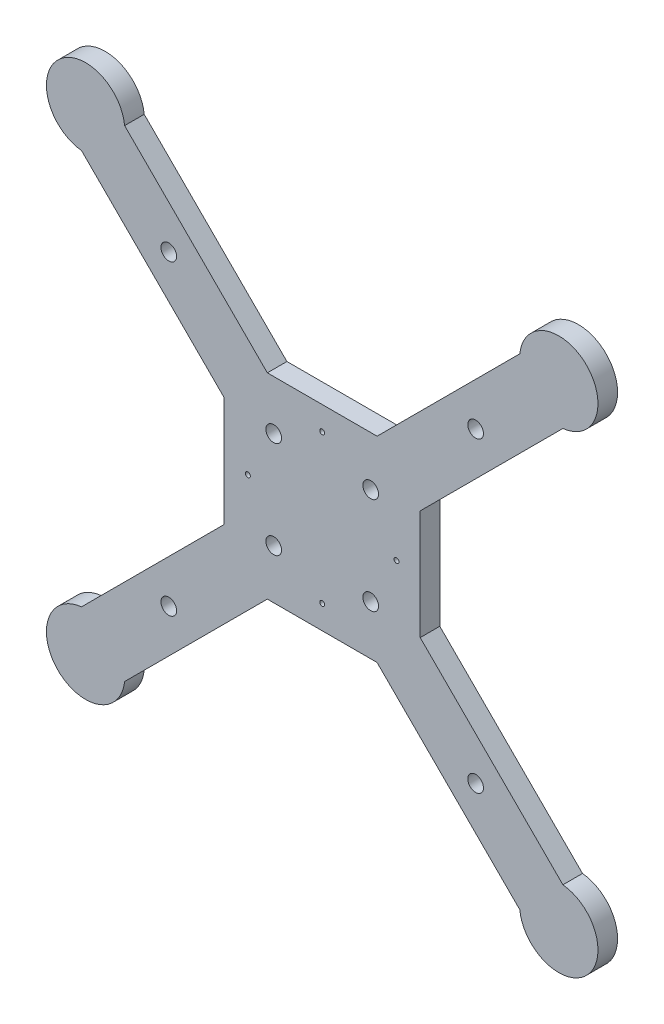
from build123d import *

# Parameters (mm, degrees)
ESQUISSE1_W             = 100
ESQUISSE1_H             = 100
BOSS_EXTRU_1_DEPTH      = 10
ESQUISSE3_R             = 4
ESQUISSE3_R_2           = 1.25
ENL_V_MAT_EXTRU_2_DEPTH = 200.246053595


with BuildPart() as part:
    # Esquisse1 → Boss.-Extru.1 (new body)
    with BuildSketch(Plane.XY):
        with BuildLine():
            ThreePointArc((-100.822483701, 122.822483701), (-134.852813742, 134.852813742), (-122.822483701, 100.822483701))
            Line((-122.822483701, 100.822483701), (-131.710678119, 109.710678119))
            Line((-131.710678119, 109.710678119), (-109.710678119, 131.710678119))
            Line((-109.710678119, 131.710678119), (-100.822483701, 122.822483701))
        make_face()
        with BuildLine():
            Line((-131.710678119, 109.710678119), (-122.822483701, 100.822483701))
            ThreePointArc((-122.822483701, 100.822483701), (-107.336002639, 105.840639254), (-100.710678119, 120.710678119))
            ThreePointArc((-100.710678119, 120.710678119), (-100.738649074, 121.768059709), (-100.822483701, 122.822483701))
            Line((-100.822483701, 122.822483701), (-109.710678119, 131.710678119))
            Line((-109.710678119, 131.710678119), (-131.710678119, 109.710678119))
        make_face()
        with BuildLine():
            Line((-122.822483701, 100.822483701), (-50, 28))
            Line((-50, 28), (-50, 50))
            Line((-50, 50), (-28, 50))
            Line((-28, 50), (-100.822483701, 122.822483701))
            ThreePointArc((-100.822483701, 122.822483701), (-100.738649074, 121.768059709), (-100.710678119, 120.710678119))
            ThreePointArc((-100.710678119, 120.710678119), (-107.336002639, 105.840639254), (-122.822483701, 100.822483701))
        make_face()
        with BuildLine():
            Line((100.822483701, 122.822483701), (28, 50))
            Line((28, 50), (50, 50))
            Line((50, 50), (50, 28))
            Line((50, 28), (122.822483701, 100.822483701))
            ThreePointArc((122.822483701, 100.822483701), (106.568542495, 106.568542495), (100.822483701, 122.822483701))
        make_face()
        with BuildLine():
            ThreePointArc((140.710678119, 120.710678119), (121.768059709, 140.682707164), (100.822483701, 122.822483701))
            Line((100.822483701, 122.822483701), (109.710678119, 131.710678119))
            Line((109.710678119, 131.710678119), (131.710678119, 109.710678119))
            Line((131.710678119, 109.710678119), (122.822483701, 100.822483701))
            ThreePointArc((122.822483701, 100.822483701), (135.580716983, 107.336002639), (140.710678119, 120.710678119))
        make_face()
        with BuildLine():
            Line((109.710678119, 131.710678119), (100.822483701, 122.822483701))
            ThreePointArc((100.822483701, 122.822483701), (106.568542495, 106.568542495), (122.822483701, 100.822483701))
            Line((122.822483701, 100.822483701), (131.710678119, 109.710678119))
            Line((131.710678119, 109.710678119), (109.710678119, 131.710678119))
        make_face()
        Rectangle(ESQUISSE1_W, ESQUISSE1_H)
        with BuildLine():
            ThreePointArc((122.822483701, -100.822483701), (106.568542495, -106.568542495), (100.822483701, -122.822483701))
            Line((100.822483701, -122.822483701), (109.710678119, -131.710678119))
            Line((109.710678119, -131.710678119), (131.710678119, -109.710678119))
            Line((131.710678119, -109.710678119), (122.822483701, -100.822483701))
        make_face()
        with BuildLine():
            Line((109.710678119, -131.710678119), (100.822483701, -122.822483701))
            ThreePointArc((100.822483701, -122.822483701), (121.768059709, -140.682707164), (140.710678119, -120.710678119))
            ThreePointArc((140.710678119, -120.710678119), (135.580716983, -107.336002639), (122.822483701, -100.822483701))
            Line((122.822483701, -100.822483701), (131.710678119, -109.710678119))
            Line((131.710678119, -109.710678119), (109.710678119, -131.710678119))
        make_face()
        with BuildLine():
            Line((50, -50), (28, -50))
            Line((28, -50), (100.822483701, -122.822483701))
            ThreePointArc((100.822483701, -122.822483701), (106.568542495, -106.568542495), (122.822483701, -100.822483701))
            Line((122.822483701, -100.822483701), (50, -28))
            Line((50, -28), (50, -50))
        make_face()
        with BuildLine():
            ThreePointArc((-100.710678119, -120.710678119), (-107.336002639, -105.840639254), (-122.822483701, -100.822483701))
            Line((-122.822483701, -100.822483701), (-131.710678119, -109.710678119))
            Line((-131.710678119, -109.710678119), (-109.710678119, -131.710678119))
            Line((-109.710678119, -131.710678119), (-100.822483701, -122.822483701))
            ThreePointArc((-100.822483701, -122.822483701), (-100.738649074, -121.768059709), (-100.710678119, -120.710678119))
        make_face()
        with BuildLine():
            Line((-131.710678119, -109.710678119), (-122.822483701, -100.822483701))
            ThreePointArc((-122.822483701, -100.822483701), (-134.852813742, -134.852813742), (-100.822483701, -122.822483701))
            Line((-100.822483701, -122.822483701), (-109.710678119, -131.710678119))
            Line((-109.710678119, -131.710678119), (-131.710678119, -109.710678119))
        make_face()
        with BuildLine():
            Line((-50, -50), (-50, -28))
            Line((-50, -28), (-122.822483701, -100.822483701))
            ThreePointArc((-122.822483701, -100.822483701), (-107.336002639, -105.840639254), (-100.710678119, -120.710678119))
            ThreePointArc((-100.710678119, -120.710678119), (-100.738649074, -121.768059709), (-100.822483701, -122.822483701))
            Line((-100.822483701, -122.822483701), (-28, -50))
            Line((-28, -50), (-50, -50))
        make_face()
    extrude(amount=BOSS_EXTRU_1_DEPTH)

    # Esquisse3 → Enlèv. mat.-Extru.2 (cut, through all)
    with BuildSketch(Plane(origin=(0, 0, 0), x_dir=(-1, 0, 0), z_dir=(0, 0, -1))):
        with Locations((-78.284271247, 78.284271247)):
            Circle(ESQUISSE3_R)
        with Locations((-24.748737342, 24.748737342)):
            Circle(ESQUISSE3_R)
        with Locations((78.284271247, 78.284271247)):
            Circle(ESQUISSE3_R)
        with Locations((24.748737342, 24.748737342)):
            Circle(ESQUISSE3_R)
        with Locations((78.284271247, -78.284271247)):
            Circle(ESQUISSE3_R)
        with Locations((24.748737342, -24.748737342)):
            Circle(ESQUISSE3_R)
        with Locations((-78.284271247, -78.284271247)):
            Circle(ESQUISSE3_R)
        with Locations((-24.748737342, -24.748737342)):
            Circle(ESQUISSE3_R)
        with Locations((-37.92, 0)):
            Circle(ESQUISSE3_R_2)
        with Locations((0, 37.92)):
            Circle(ESQUISSE3_R_2)
        with Locations((37.92, 0)):
            Circle(ESQUISSE3_R_2)
        with Locations((0, -37.92)):
            Circle(ESQUISSE3_R_2)
    extrude(amount=-ENL_V_MAT_EXTRU_2_DEPTH, mode=Mode.SUBTRACT)


solid = part.part
